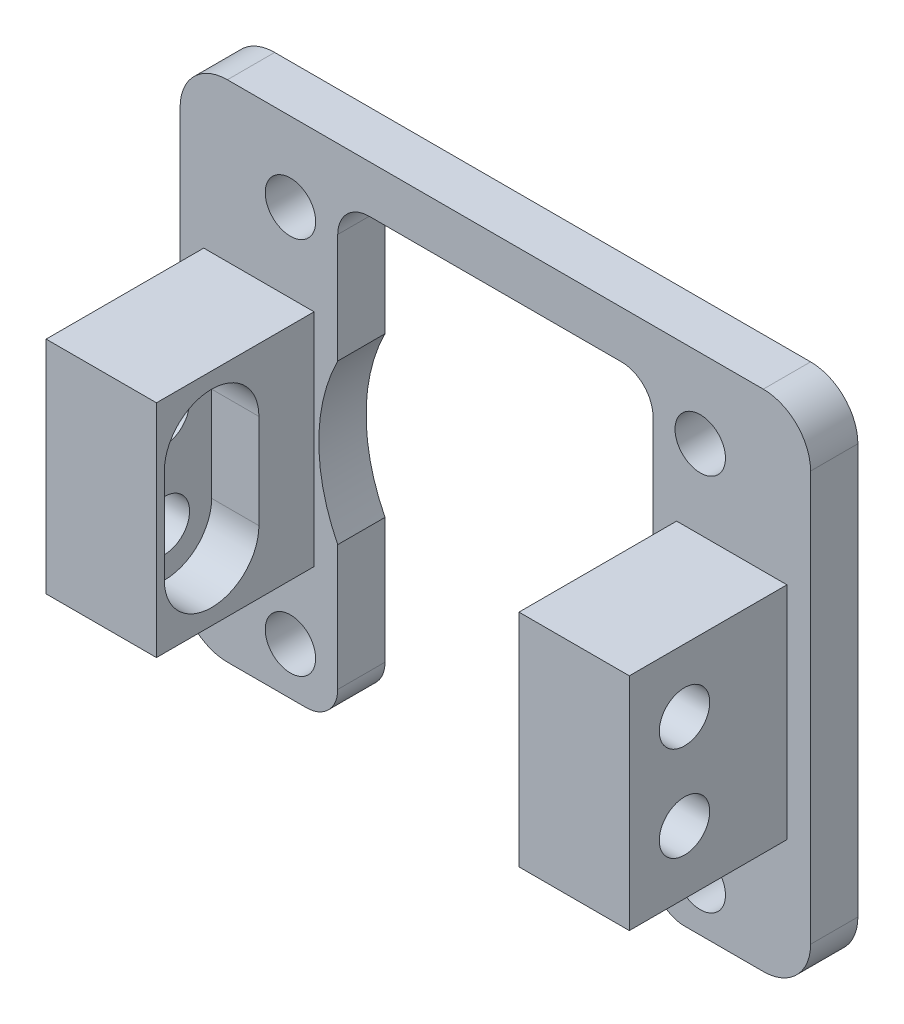
from build123d import *

# Parameters (mm, degrees)
SKETCH_1_R               = 1.6
EXTRUDE_1_DEPTH          = 3
SKETCH_2_W               = 7
SKETCH_2_H               = 14
EXTRUDE_2_DEPTH          = 10
CUT_EXTRUDE_1_DEPTH      = 115.456323547
CUT_EXTRUDE_1_DEPTH_BACK = 115.456323547
SKETCH_4_R               = 1.6
FILLET_1_R               = 2
CUT_EXTRUDE_2_DEPTH      = 3
CUT_EXTRUDE_START        = -3
CUT_EXTRUDE_3_DEPTH      = 3


with BuildPart() as part:
    # 草图1 → 凸台-拉伸1 (new body)
    with BuildSketch(Plane.XY):
        with BuildLine():
            Line((-10, 103.998111102), (-10, 95.043808085))
            ThreePointArc((-10, 95.043808085), (-11.2, 90), (-10, 84.956191915))
            Line((-10, 84.956191915), (-10, 75))
            Line((-10, 75), (-17, 75))
            ThreePointArc((-17, 75), (-19.121320344, 75.878679656), (-20, 78))
            Line((-20, 78), (-20, 104))
            ThreePointArc((-20, 104), (-19.121320344, 106.121320344), (-17, 107))
            Line((-17, 107), (17, 107))
            ThreePointArc((17, 107), (19.121320344, 106.121320344), (20, 104))
            Line((20, 104), (20, 78))
            ThreePointArc((20, 78), (19.121320344, 75.878679656), (17, 75))
            Line((17, 75), (10, 75))
            Line((10, 75), (10, 84.956191915))
            ThreePointArc((10, 84.956191915), (11.2, 90), (10, 95.043808085))
            Line((10, 95.043808085), (10, 103.998111102))
            Line((10, 103.998111102), (-10, 103.998111102))
        make_face()
        with Locations((-13, 102)):
            Circle(SKETCH_1_R, mode=Mode.SUBTRACT)
        with Locations((-13, 78)):
            Circle(SKETCH_1_R, mode=Mode.SUBTRACT)
        with Locations(Location((13, 102, 0), (0, 0, 180))):
            Circle(SKETCH_1_R, mode=Mode.SUBTRACT)
        with Locations(Location((13, 78, 0), (0, 0, 180))):
            Circle(SKETCH_1_R, mode=Mode.SUBTRACT)
    extrude(amount=EXTRUDE_1_DEPTH)

    # 草图2 → 凸台-拉伸2 (add)
    with BuildSketch(Plane.XY.offset(3)):
        with Locations((-15, 90)):
            Rectangle(SKETCH_2_W, SKETCH_2_H)
        with Locations((15, 90)):
            Rectangle(SKETCH_2_W, SKETCH_2_H)
    extrude(amount=EXTRUDE_2_DEPTH)

    # 草图4 → 切除-拉伸1 (cut, two sides: drawn at the far end of the back side and taken through both)
    with BuildSketch(Plane.ZY.offset(18.5).offset(-CUT_EXTRUDE_1_DEPTH_BACK)):
        with Locations((9.5, 93)):
            Circle(SKETCH_4_R)
        with Locations((9.5, 87)):
            Circle(SKETCH_4_R)
    extrude(amount=CUT_EXTRUDE_1_DEPTH + CUT_EXTRUDE_1_DEPTH_BACK, mode=Mode.SUBTRACT)

    # 圆角1
    fillet_1_edges = [part.edges().sort_by_distance(p)[0] for p in [
        (-10, 75, 1.5),
        (10, 75, 1.5),
        (10, 103.998111102, 1.5),
        (-10, 103.998111102, 1.5),
    ]]
    fillet(fillet_1_edges, radius=FILLET_1_R)

    # 草图5 → 切除-拉伸2 (cut)
    with BuildSketch(Plane.ZY.offset(-11.5)):
        with BuildLine():
            Line((12.5, 93), (12.5, 87))
            ThreePointArc((12.5, 87), (9.5, 84), (6.5, 87))
            Line((6.5, 87), (6.5, 93))
            ThreePointArc((6.5, 93), (9.5, 96), (12.5, 93))
        make_face()
    extrude(amount=-CUT_EXTRUDE_2_DEPTH, mode=Mode.SUBTRACT)

    # 草图6 → 切除-拉伸3 (cut)
    with BuildSketch(Plane(origin=(-11.5, 0, 0), x_dir=(0, 0, -1), z_dir=(1, 0, 0)).offset(CUT_EXTRUDE_START)):
        with BuildLine():
            Line((-6.5, 93), (-6.5, 87))
            ThreePointArc((-6.5, 87), (-9.5, 84), (-12.5, 87))
            Line((-12.5, 87), (-12.5, 93))
            ThreePointArc((-12.5, 93), (-9.5, 96), (-6.5, 93))
        make_face()
    extrude(amount=CUT_EXTRUDE_3_DEPTH, mode=Mode.SUBTRACT)


solid = part.part
